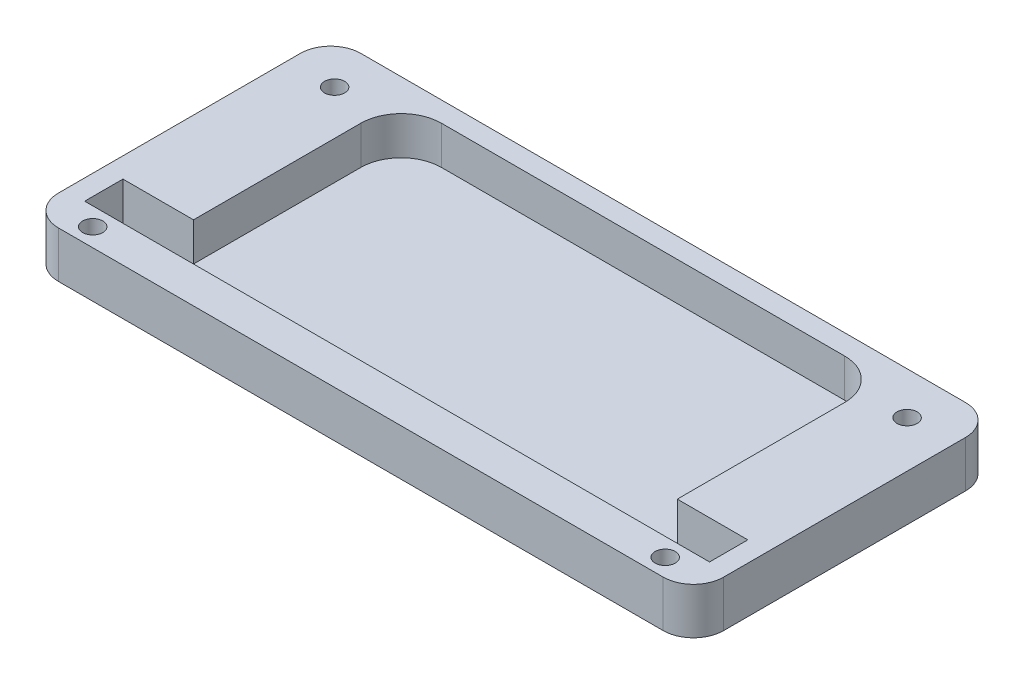
from build123d import *

# Parameters (mm, degrees)
SKETCH_1_W      = 165
SKETCH_1_H      = 75
SKETCH_1_R      = 2.5
EXTRUDE_1_DEPTH = 9.5
EXTRUDE_START   = -2
SKETCH_1_2_W    = 165
SKETCH_1_2_H    = 75
SKETCH_1_2_R    = 2.5
EXTRUDE_2_DEPTH = 2
FILLET_1_R      = 10
FILLET_2_R      = 7.5


with BuildPart() as part:
    # Эскиз1 → Бобышка-Вытянуть1 (new body)
    with BuildSketch(Plane(origin=(0, 0, 0), x_dir=(1, 0, 0), z_dir=(0, 1, 0))):
        with Locations((0, 23.75)):
            Rectangle(SKETCH_1_W, SKETCH_1_H)
        with Locations((-71, -9.25)):
            Circle(SKETCH_1_R, mode=Mode.SUBTRACT)
        with Locations((-71, 50.75)):
            Circle(SKETCH_1_R, mode=Mode.SUBTRACT)
        with Locations((71, -9.25)):
            Circle(SKETCH_1_R, mode=Mode.SUBTRACT)
        with Locations((71, 50.75)):
            Circle(SKETCH_1_R, mode=Mode.SUBTRACT)
        Polygon((77.5, -4.75), (-77.5, -4.75), (-77.5, 4.75), (-60, 4.75), (-60, 56.25), (60, 56.25), (60, 4.75), (77.5, 4.75), align=None, mode=Mode.SUBTRACT)
    extrude(amount=EXTRUDE_1_DEPTH)

    # Эскиз1<2> → Бобышка-Вытянуть2 (add)
    with BuildSketch(Plane(origin=(0, 0, 0), x_dir=(1, 0, 0), z_dir=(0, 1, 0)).offset(EXTRUDE_START)):
        with Locations((0, 23.75)):
            Rectangle(SKETCH_1_2_W, SKETCH_1_2_H)
        with Locations((-71, -9.25)):
            Circle(SKETCH_1_2_R, mode=Mode.SUBTRACT)
        with Locations((71, -9.25)):
            Circle(SKETCH_1_2_R, mode=Mode.SUBTRACT)
        with Locations((-71, 50.75)):
            Circle(SKETCH_1_2_R, mode=Mode.SUBTRACT)
        with Locations((71, 50.75)):
            Circle(SKETCH_1_2_R, mode=Mode.SUBTRACT)
    extrude(amount=EXTRUDE_2_DEPTH)

    # Скругление1
    fillet_1_edges = [part.edges().sort_by_distance(p)[0] for p in [
        (60, 4.75, -56.25),
        (-60, 4.75, -56.25),
    ]]
    fillet(fillet_1_edges, radius=FILLET_1_R)

    # Скругление2
    fillet_2_edges = [part.edges().sort_by_distance(p)[0] for p in [
        (82.5, 3.75, 13.75),
        (82.5, 3.75, -61.25),
        (-82.5, 3.75, -61.25),
        (-82.5, 3.75, 13.75),
    ]]
    fillet(fillet_2_edges, radius=FILLET_2_R)


solid = part.part
